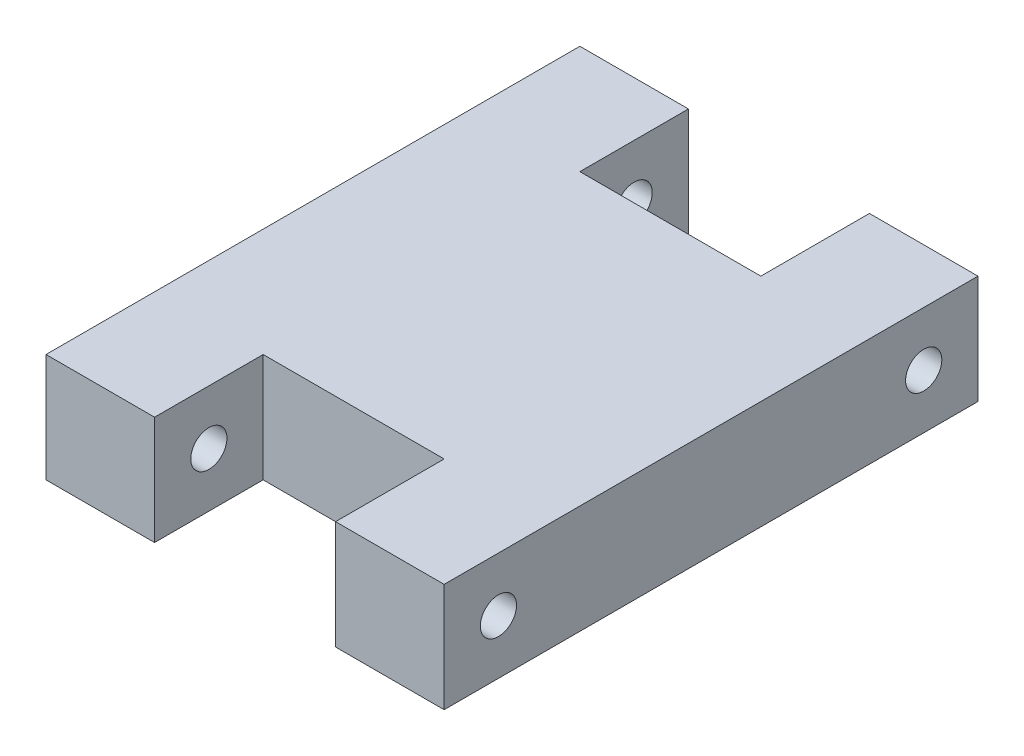
from build123d import *

# Parameters (mm, degrees)
SKETCH1_W           = 44
SKETCH1_H           = 59
BOSS_EXTRUDE1_DEPTH = 12
CUT_EXTRUDE1_REACH  = 40.707
SKETCH2_W           = 20
SKETCH2_H           = 12
CUT_EXTRUDE2_REACH  = 56.316
SKETCH3_R           = 2


with BuildPart() as part:
    # Sketch1 → Boss-Extrude1 (new body)
    with BuildSketch(Plane(origin=(0, 0, 0), x_dir=(1, 0, 0), z_dir=(0, 1, 0))):
        Rectangle(SKETCH1_W, SKETCH1_H)
    extrude(amount=BOSS_EXTRUDE1_DEPTH)

    # Sketch2 → Cut-Extrude1 (cut, up to next)
    with BuildSketch(Plane(origin=(0, 12, 0), x_dir=(1, 0, 0), z_dir=(0, 1, 0)), mode=Mode.PRIVATE) as cut_extrude1_sk1:
        with Locations((0, 23.5)):
            Rectangle(SKETCH2_W, SKETCH2_H)
    cut_extrude1_tool1 = extrude(cut_extrude1_sk1.sketch, amount=-CUT_EXTRUDE1_REACH, mode=Mode.PRIVATE) & part.part
    # Sketch2 → Cut-Extrude1 (cut, up to next)
    with BuildSketch(Plane(origin=(0, 12, 0), x_dir=(1, 0, 0), z_dir=(0, 1, 0)), mode=Mode.PRIVATE) as cut_extrude1_sk2:
        with Locations((0, -23.5)):
            Rectangle(SKETCH2_W, SKETCH2_H)
    cut_extrude1_tool2 = extrude(cut_extrude1_sk2.sketch, amount=-CUT_EXTRUDE1_REACH, mode=Mode.PRIVATE) & part.part
    add(cut_extrude1_tool1.solids().sort_by_distance((0, 12, -23.5))[0], mode=Mode.SUBTRACT)
    add(cut_extrude1_tool2.solids().sort_by_distance((0, 12, 23.5))[0], mode=Mode.SUBTRACT)

    # Cut-Extrude2: up to this face of the body (flat: up to its plane)
    cut_extrude2_end = Plane(part.part.faces().sort_by_distance((22, 6, 0))[0])
    # Sketch3 → Cut-Extrude2 (cut, up to the picked face)
    with BuildSketch(Plane.ZY.offset(22), mode=Mode.PRIVATE) as cut_extrude2_sk1:
        with Locations((-23.5, 6)):
            Circle(SKETCH3_R)
    cut_extrude2_tool1 = split(extrude(cut_extrude2_sk1.sketch, amount=-CUT_EXTRUDE2_REACH, mode=Mode.PRIVATE), bisect_by=cut_extrude2_end, keep=Keep.BOTH, mode=Mode.PRIVATE)
    cut_extrude2 = cut_extrude2_tool1.solids().sort_by(Axis((-22, 6, -23.5), (1, 0, 0)))[0]
    add(cut_extrude2, mode=Mode.SUBTRACT)

    # Mirror1: Cut-Extrude2 across plane
    add(cut_extrude2.mirror(Plane.XY), mode=Mode.SUBTRACT)


solid = part.part
